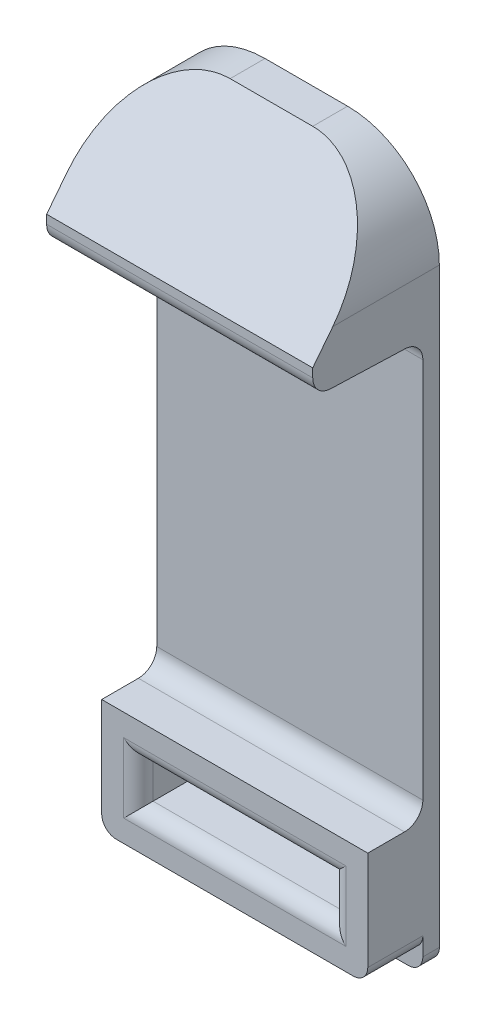
from build123d import *

# Parameters (mm, degrees)
SKETCH1_W           = 14.5
SKETCH1_H           = 38
SKETCH1_W_2         = 10.5
SKETCH1_H_2         = 2.2
BOSS_EXTRUDE1_DEPTH = 0.9
SKETCH2_W           = 14.5
SKETCH2_H           = 8.05
BOSS_EXTRUDE2_DEPTH = 6
DRAFT1_ANGLE        = 2
SKETCH2_3_W         = 14.5
SKETCH2_3_H         = 6.2
SKETCH2_3_W_2       = 10.5
SKETCH2_3_H_2       = 2.2
BOSS_EXTRUDE3_DEPTH = 3
CHAMFER1_SIZE       = 5
CHAMFER1_SIZE2      = 6.399708161
FILLET2_R           = 1
FILLET3_R           = 1
FILLET4_R           = 5
FILLET5_R           = 0.8


with BuildPart() as part:
    # Sketch1 → Boss-Extrude1 (new body)
    with BuildSketch(Plane.XY):
        with Locations((0, 16)):
            Rectangle(SKETCH1_W, SKETCH1_H)
        with Locations((0, 1.1)):
            Rectangle(SKETCH1_W_2, SKETCH1_H_2, mode=Mode.SUBTRACT)
    extrude(amount=BOSS_EXTRUDE1_DEPTH)

    # Sketch2 → Boss-Extrude2 (add)
    with BuildSketch(Plane.XY.offset(0.9)):
        with Locations((0, 30.975)):
            Rectangle(SKETCH2_W, SKETCH2_H)
    extrude(amount=BOSS_EXTRUDE2_DEPTH)

    # Draft1
    draft1_faces = [part.faces().sort_by_distance(p)[0] for p in [
        (0, 26.95, 3.9),
    ]]
    draft(draft1_faces, Plane.XY.offset(0.9), DRAFT1_ANGLE)

    # Sketch2<3> → Boss-Extrude3 (add)
    with BuildSketch(Plane.XY.offset(0.9)):
        with Locations((0, 1.1)):
            Rectangle(SKETCH2_3_W, SKETCH2_3_H)
        with Locations((0, 1.1)):
            Rectangle(SKETCH2_3_W_2, SKETCH2_3_H_2, mode=Mode.SUBTRACT)
    extrude(amount=BOSS_EXTRUDE3_DEPTH)

    # Chamfer1
    chamfer1_edges = [part.edges().sort_by_distance(p)[0] for p in [
        (0, 35, 6.9),
    ]]
    chamfer1_side = [part.faces().sort_by_distance(p)[0] for p in [
        (0, 35, 3.45),
    ]]
    chamfer(chamfer1_edges, length=CHAMFER1_SIZE, length2=CHAMFER1_SIZE2, reference=chamfer1_side[0])

    # Fillet2
    fillet2_edges = [part.edges().sort_by_distance(p)[0] for p in [
        (0, 27.159524617, 6.9),
    ]]
    fillet(fillet2_edges, radius=FILLET2_R)

    # Fillet3
    fillet3_edges = [part.edges().sort_by_distance(p)[0] for p in [
        (0, 26.95, 0.9),
        (0, 4.2, 0.9),
    ]]
    fillet(fillet3_edges, radius=FILLET3_R)

    # Fillet4
    fillet4_edges = [part.edges().sort_by_distance(p)[0] for p in [
        (7.25, 35, 0.95),
        (-7.25, 35, 0.95),
    ]]
    fillet(fillet4_edges, radius=FILLET4_R)

    # Fillet5
    fillet5_edges = [part.edges().sort_by_distance(p)[0] for p in [
        (0, 0, 3.9),
        (5.25, 1.1, 3.9),
        (-5.25, 1.1, 3.9),
        (0, 2.2, 3.9),
        (7.25, -2, 2.4),
        (7.25, -3, 0.45),
        (-7.25, -2, 2.4),
        (-7.25, -3, 0.45),
    ]]
    fillet(fillet5_edges, radius=FILLET5_R)


solid = part.part
